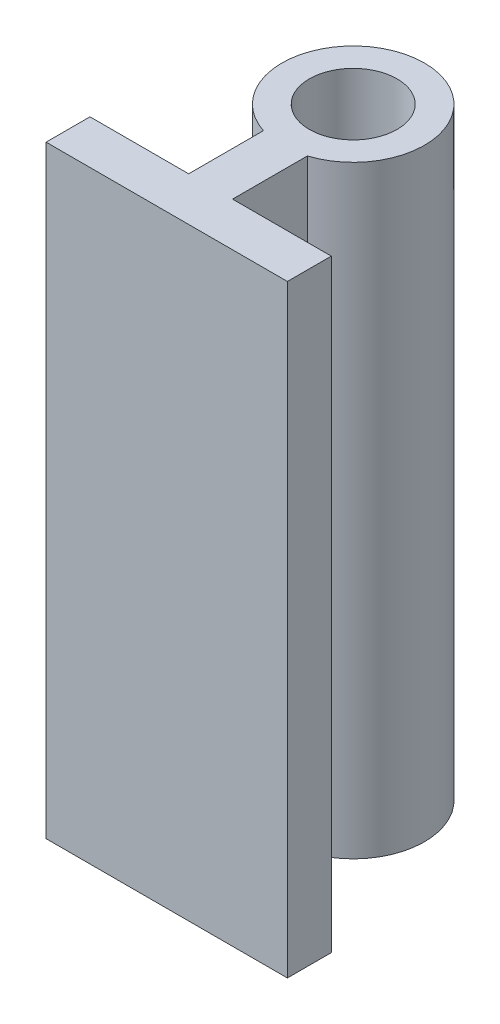
from build123d import *

# Parameters (mm, degrees)
SKETCH_1_W      = 9
SKETCH_1_H      = 4
EXTRUDE_1_DEPTH = 55


with BuildPart() as part:
    # Эскиз1 → Бобышка-Вытянуть1 (new body)
    with BuildSketch(Plane(origin=(0, 0, 0), x_dir=(1, 0, 0), z_dir=(0, 1, 0))):
        with BuildLine():
            ThreePointArc((6.5, 0), (4.596194078, 4.596194078), (0, 6.5))
            Line((0, 6.5), (0, 4))
            ThreePointArc((0, 4), (2.828427125, 2.828427125), (4, 0))
            ThreePointArc((4, 0), (3.464101615, -2), (2, -3.464101615))
            Line((2, -3.464101615), (2, -6.184658438))
            ThreePointArc((2, -6.184658438), (5.25594901, -3.824264635), (6.5, 0))
        make_face()
        with BuildLine():
            Line((0, -4), (0, -6.5))
            ThreePointArc((0, -6.5), (1.01235373, -6.420680643), (2, -6.184658438))
            Line((2, -6.184658438), (2, -3.464101615))
            ThreePointArc((2, -3.464101615), (1.03527618, -3.863703305), (0, -4))
        make_face()
        with BuildLine():
            ThreePointArc((2, -6.184658438), (1.01235373, -6.420680643), (0, -6.5))
            Line((0, -6.5), (0, -17))
            Line((0, -17), (2, -17))
            Line((2, -17), (2, -13))
            Line((2, -13), (2, -6.184658438))
        make_face()
        with Locations((6.5, -15)):
            Rectangle(SKETCH_1_W, SKETCH_1_H)
    extrude(amount=EXTRUDE_1_DEPTH)

    # Зеркальное отражение1: part across plane


with BuildPart() as part_1:
    add(part.part)
    add(part.part.mirror(Plane(origin=(0, 55, 0), x_dir=(0, 0, 1), z_dir=(1, 0, 0))))


solid = part_1.part
